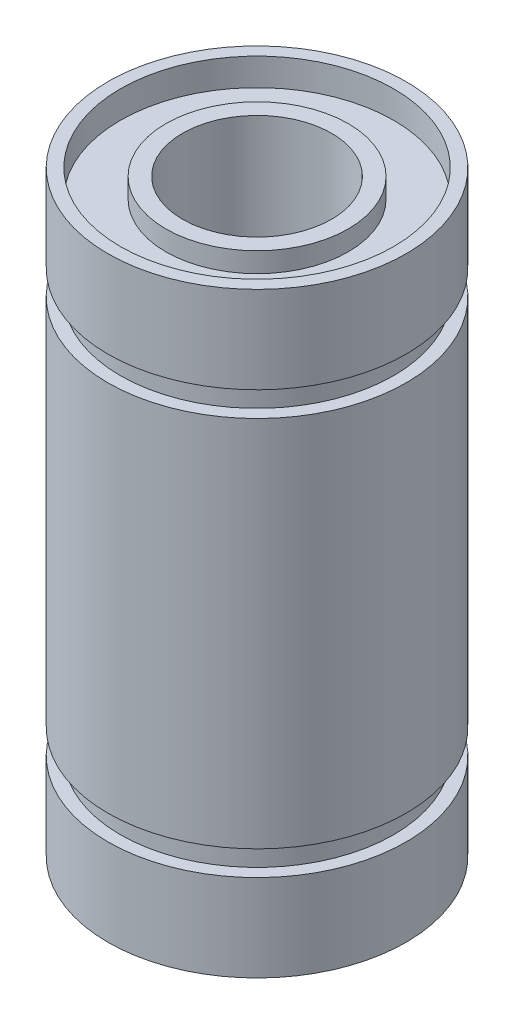
from build123d import *

# Parameters (mm, degrees)
SKETCH1_R           = 6
BOSS_EXTRUDE1_DEPTH = 12
SKETCH2_R           = 3
CUT_EXTRUDE1_DEPTH  = 24
CUT_EXTRUDE2_START  = -3.5
SKETCH3_R           = 6
SKETCH3_R_2         = 5.5
CUT_EXTRUDE2_DEPTH  = 1


with BuildPart() as part:
    # Sketch1 → Boss-Extrude1 (new, symmetric)
    with BuildSketch(Plane(origin=(0, 0, 0), x_dir=(1, 0, 0), z_dir=(0, 1, 0))):
        with Locations(Location((0, 0, 0), (0, 0, 270))):
            Circle(SKETCH1_R)
    extrude(amount=BOSS_EXTRUDE1_DEPTH, both=True)

    # Sketch2 → Cut-Extrude1 (cut)
    with BuildSketch(Plane(origin=(0, 12, 0), x_dir=(1, 0, 0), z_dir=(0, 1, 0))):
        with Locations(Location((0, 0, 0), (0, 0, 270))):
            Circle(SKETCH2_R)
    extrude(amount=-CUT_EXTRUDE1_DEPTH, mode=Mode.SUBTRACT)

    # Sketch3 → Cut-Extrude2 (cut)
    with BuildSketch(Plane(origin=(0, 12, 0), x_dir=(1, 0, 0), z_dir=(0, 1, 0)).offset(CUT_EXTRUDE2_START)):
        with Locations(Location((0, 0, 0), (0, 0, 270))):
            Circle(SKETCH3_R)
        with Locations(Location((0, 0, 0), (0, 0, 270))):
            Circle(SKETCH3_R_2, mode=Mode.SUBTRACT)
    cut_extrude2 = extrude(amount=-CUT_EXTRUDE2_DEPTH, mode=Mode.SUBTRACT)

    # Sketch4 → Cut-Revolve1 (revolve, cut)
    with BuildSketch(Plane(origin=(0, 0, 0), x_dir=(0, 0, -1), z_dir=(1, 0, 0)), mode=Mode.PRIVATE) as cut_revolve1_sk:
        Polygon((3, 12), (3, 11.7), (3.670767282, 11.7), (3.670767282, 10.9), (5.5, 10.9), (5.5, 12), align=None)
    cut_revolve1 = revolve(cut_revolve1_sk.sketch.rotate(Axis((0, 10.5, 0), (0, -1, 0)), 180), axis=Axis((0, 10.5, 0), (0, -1, 0)), mode=Mode.SUBTRACT)

    # Mirror1: Cut-Extrude2, Cut-Revolve1 across plane
    add(cut_extrude2.mirror(Plane.ZX), mode=Mode.SUBTRACT)
    add(cut_revolve1.mirror(Plane.ZX), mode=Mode.SUBTRACT)


solid = part.part
